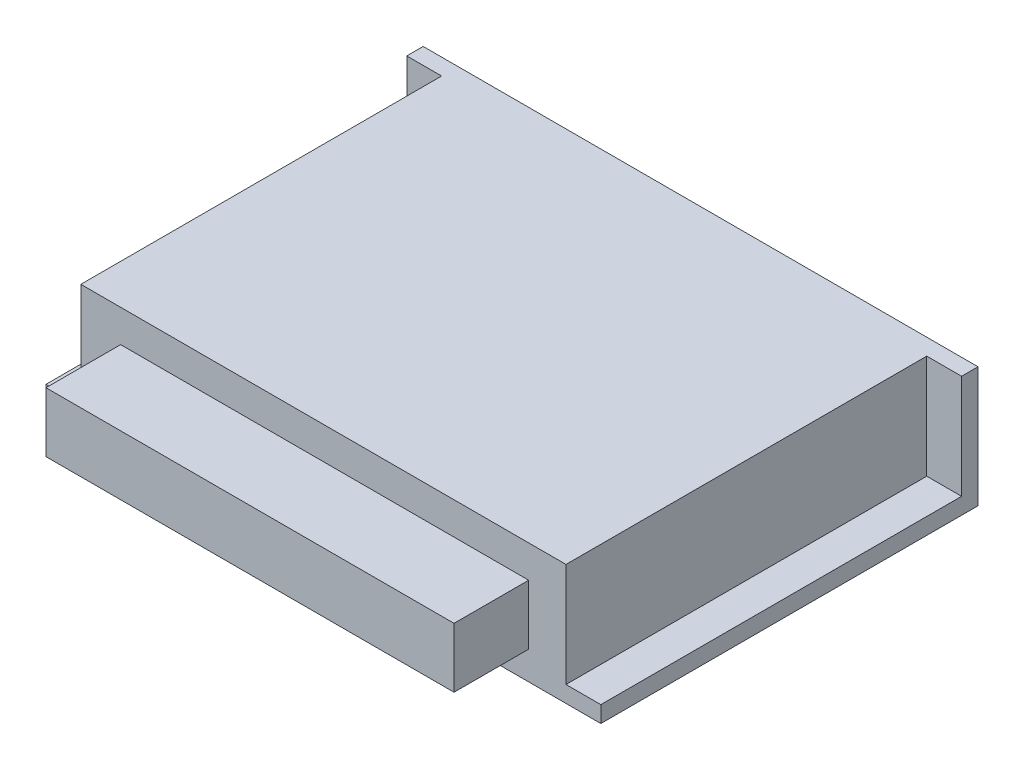
from build123d import *

# Parameters (mm, degrees)
SKETCH1_W           = 111.5
SKETCH1_H           = 75.8
BOSS_EXTRUDE1_DEPTH = 3.3
BOSS_EXTRUDE2_DEPTH = 20.9
SKETCH3_W           = 82
SKETCH3_H           = 12
BOSS_EXTRUDE3_DEPTH = 15


with BuildPart() as part:
    # Sketch1 → Boss-Extrude1 (new body)
    with BuildSketch(Plane(origin=(0, 0, 0), x_dir=(1, 0, 0), z_dir=(0, 1, 0))):
        Rectangle(SKETCH1_W, SKETCH1_H)
    extrude(amount=BOSS_EXTRUDE1_DEPTH)

    # Sketch2 → Boss-Extrude2 (add)
    with BuildSketch(Plane(origin=(0, 3.3, 0), x_dir=(1, 0, 0), z_dir=(0, 1, 0))):
        Polygon((48.75, 37.9), (-48.75, 37.9), (-55.75, 37.9), (-55.75, 34.6), (-48.75, 34.6), (-48.75, -37.9), (48.75, -37.9), (48.75, 34.6), (55.75, 34.6), (55.75, 37.9), align=None)
    extrude(amount=BOSS_EXTRUDE2_DEPTH)

    # Sketch3 → Boss-Extrude3 (add)
    with BuildSketch(Plane.XY.offset(37.9)):
        with Locations((0.25, 11.7)):
            Rectangle(SKETCH3_W, SKETCH3_H)
    extrude(amount=BOSS_EXTRUDE3_DEPTH)


solid = part.part
